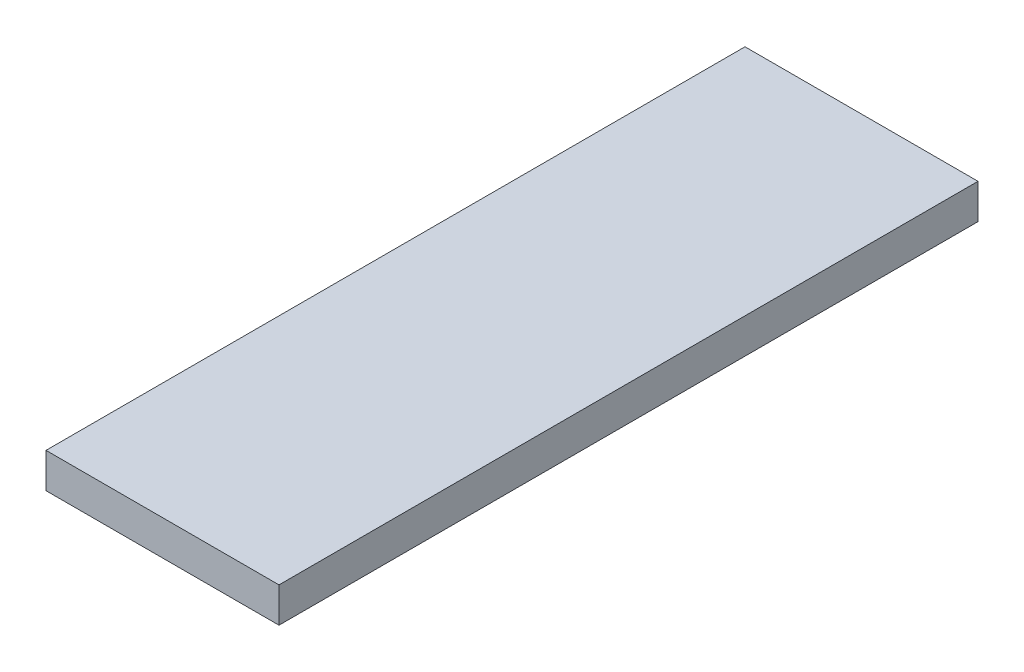
from build123d import *

# Parameters (mm, degrees)
SKETCH1_W           = 20
SKETCH1_H           = 3
BOSS_EXTRUDE1_DEPTH = 60


with BuildPart() as part:
    # Sketch1 → Boss-Extrude1 (new body)
    with BuildSketch(Plane.XY):
        with Locations((10, -1.5)):
            Rectangle(SKETCH1_W, SKETCH1_H)
    extrude(amount=BOSS_EXTRUDE1_DEPTH)


solid = part.part
